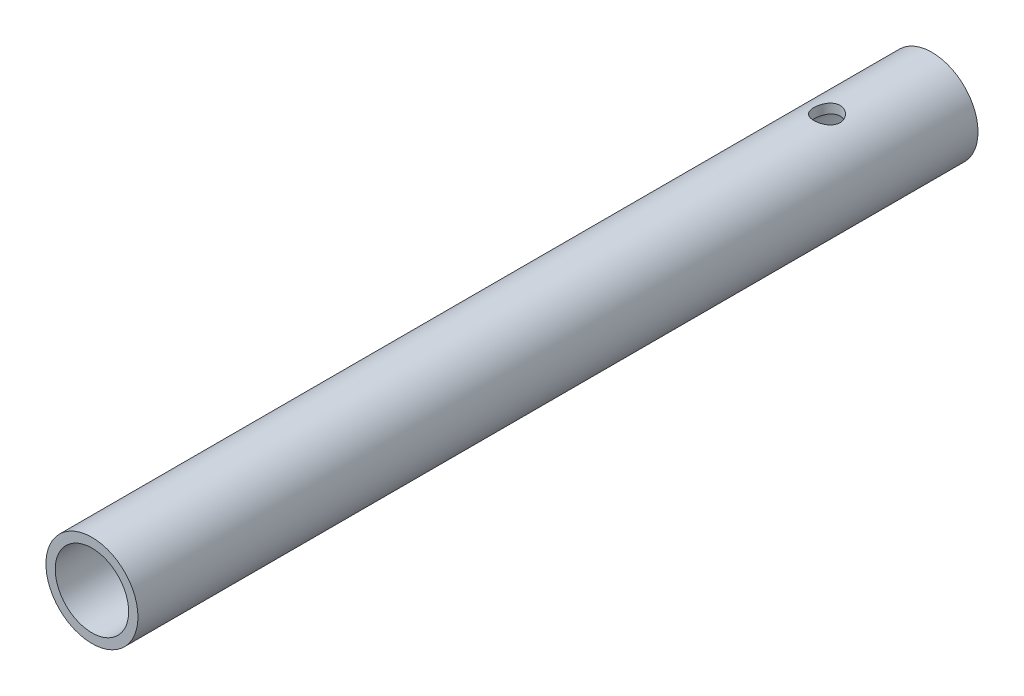
from build123d import *

# Parameters (mm, degrees)
SKETCH2_R               = 16.7005
SKETCH2_R_2             = 13.3223
PIPE_EXTRUDE_DEPTH      = 152.4
CUT_EXTRUDE1_DEPTH      = 155.219238101
CUT_EXTRUDE1_DEPTH_BACK = 155.219238101
SKETCH3_R               = 4.7625


with BuildPart() as part:
    # Sketch2 → Pipe Extrude (new, symmetric)
    with BuildSketch(Plane.XY):
        Circle(SKETCH2_R)
        Circle(SKETCH2_R_2, mode=Mode.SUBTRACT)
    extrude(amount=PIPE_EXTRUDE_DEPTH, both=True)

    # Sketch3 → Cut-Extrude1 (cut, two sides: drawn at the far end of the back side and taken through both)
    with BuildSketch(Plane(origin=(0, 0, 0), x_dir=(1, 0, 0), z_dir=(0, 1, 0)).offset(-CUT_EXTRUDE1_DEPTH_BACK)):
        with Locations((0, 114.3)):
            Circle(SKETCH3_R)
    extrude(amount=CUT_EXTRUDE1_DEPTH + CUT_EXTRUDE1_DEPTH_BACK, mode=Mode.SUBTRACT)


solid = part.part
